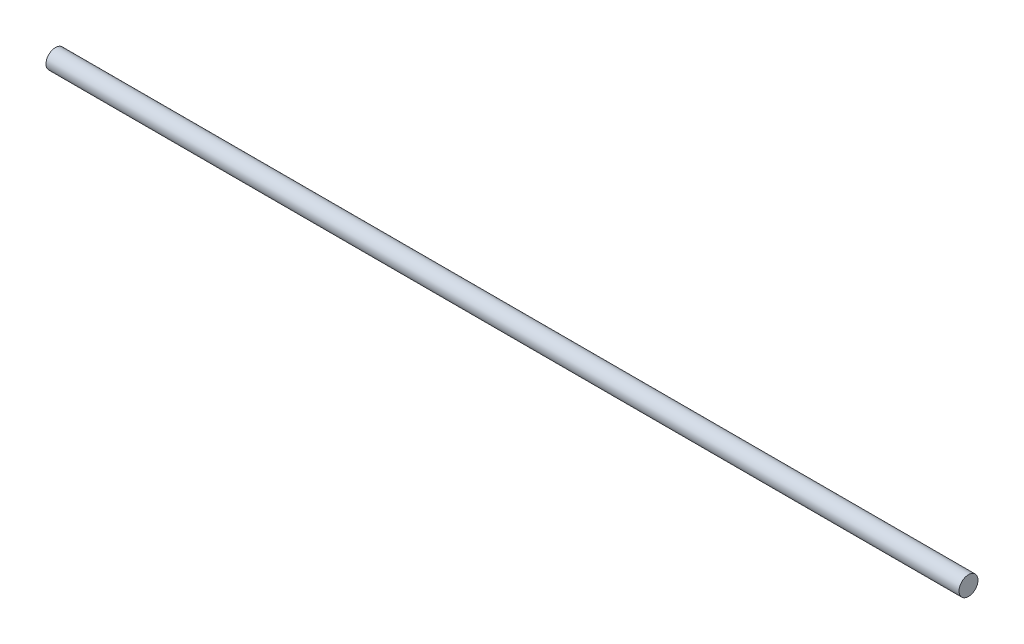
from build123d import *

# Parameters (mm, degrees)
SKETCH_1_R      = 4
EXTRUDE_1_DEPTH = 385


with BuildPart() as part:
    # 草图1 → 凸台-拉伸1 (new body)
    with BuildSketch(Plane(origin=(0, 0, 0), x_dir=(0, 0, -1), z_dir=(1, 0, 0))):
        Circle(SKETCH_1_R)
    extrude(amount=EXTRUDE_1_DEPTH)


solid = part.part
